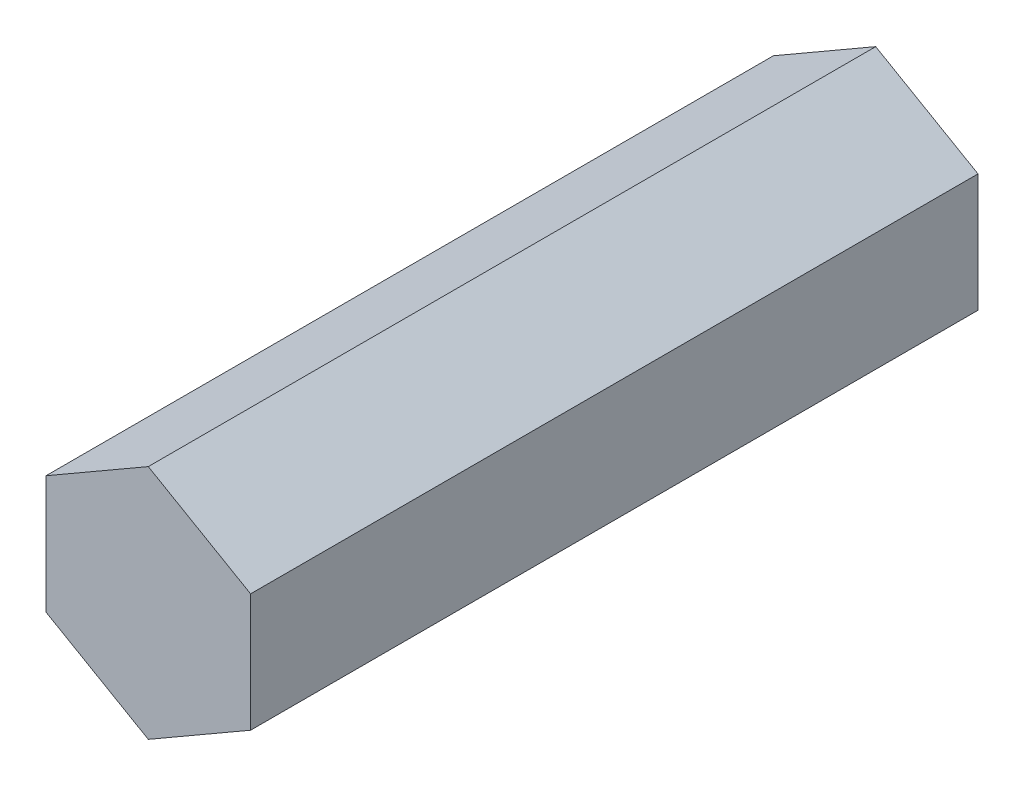
from build123d import *

# Parameters (mm, degrees)
BOSS_EXTRUDE1_DEPTH = 25.4


with BuildPart() as part:
    # Sketch3 → Boss-Extrude1 (new, symmetric)
    with BuildSketch(Plane.XY):
        Polygon((0, 8.248891971), (7.14375, 4.124445986), (7.14375, -4.124445986), (0, -8.248891971), (-7.14375, -4.124445986), (-7.14375, 4.124445986), align=None)
    extrude(amount=BOSS_EXTRUDE1_DEPTH, both=True)


solid = part.part
